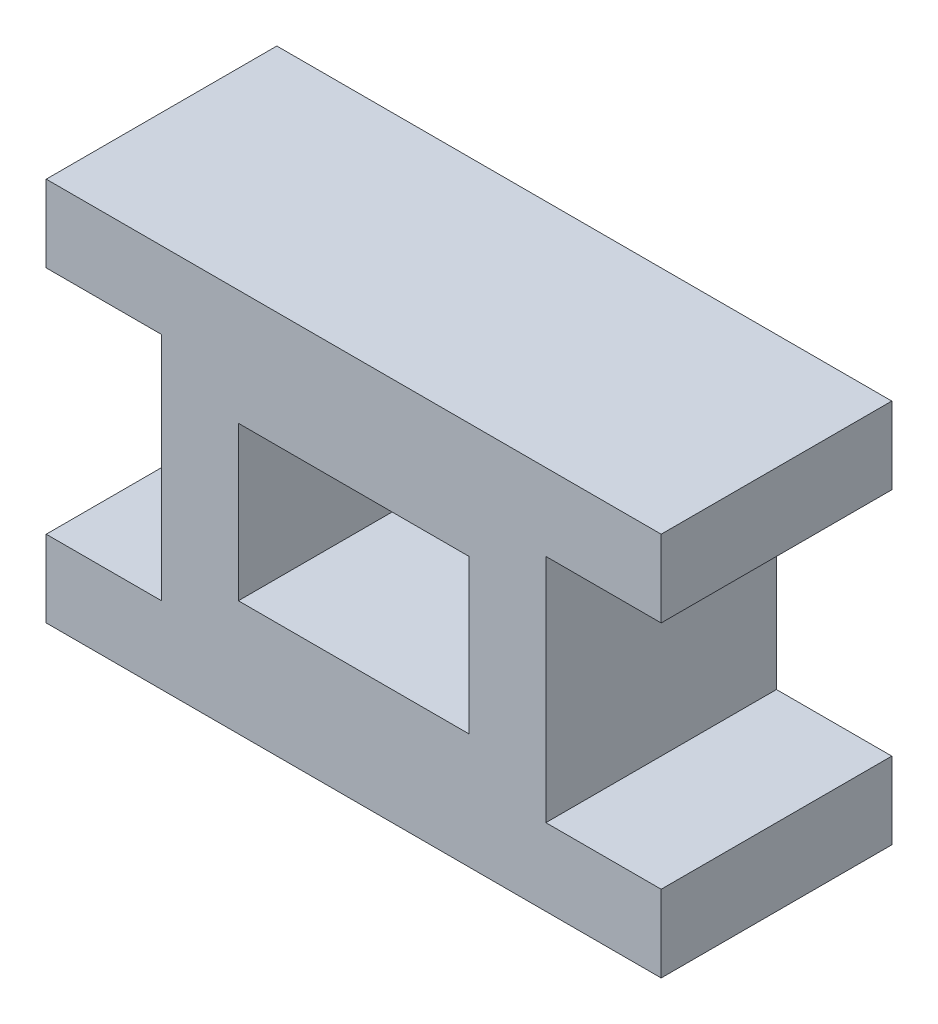
from build123d import *

# Parameters (mm, degrees)
SKETCH1_W           = 30
SKETCH1_H           = 20
BOSS_EXTRUDE1_DEPTH = 15


with BuildPart() as part:
    # Sketch1 → Boss-Extrude1 (new, symmetric)
    with BuildSketch(Plane.XY):
        Polygon((-40, 15), (-25, 15), (-25, -15), (-40, -15), (-40, -25), (40, -25), (40, -15), (25, -15), (25, 15), (40, 15), (40, 25), (-40, 25), align=None)
        Rectangle(SKETCH1_W, SKETCH1_H, mode=Mode.SUBTRACT)
    extrude(amount=BOSS_EXTRUDE1_DEPTH, both=True)


solid = part.part
